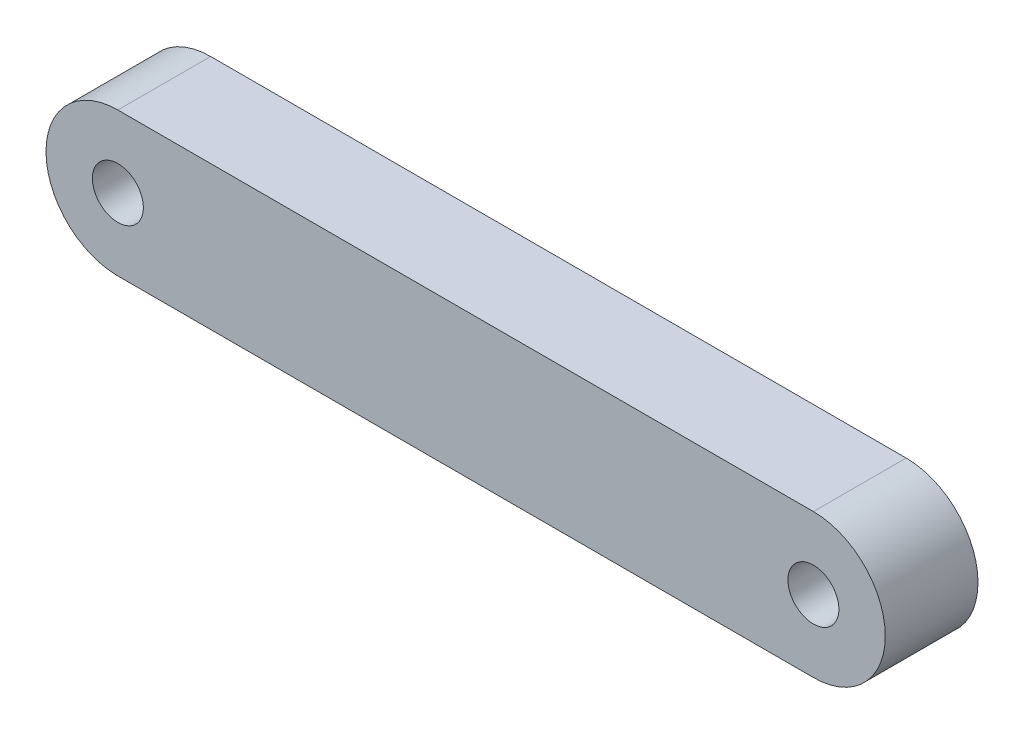
from build123d import *

# Parameters (mm, degrees)
SKETCH1_R           = 1.1
BOSS_EXTRUDE1_DEPTH = 4


with BuildPart() as part:
    # Sketch1 → Boss-Extrude1 (new body)
    with BuildSketch(Plane.XY):
        with BuildLine():
            Line((0, 3.1), (30, 3.1))
            ThreePointArc((30, 3.1), (33.1, 0), (30, -3.1))
            Line((30, -3.1), (0, -3.1))
            ThreePointArc((0, -3.1), (-3.1, 0), (0, 3.1))
        make_face()
        Circle(SKETCH1_R, mode=Mode.SUBTRACT)
        with Locations((30, 0)):
            Circle(SKETCH1_R, mode=Mode.SUBTRACT)
    extrude(amount=BOSS_EXTRUDE1_DEPTH)


solid = part.part
